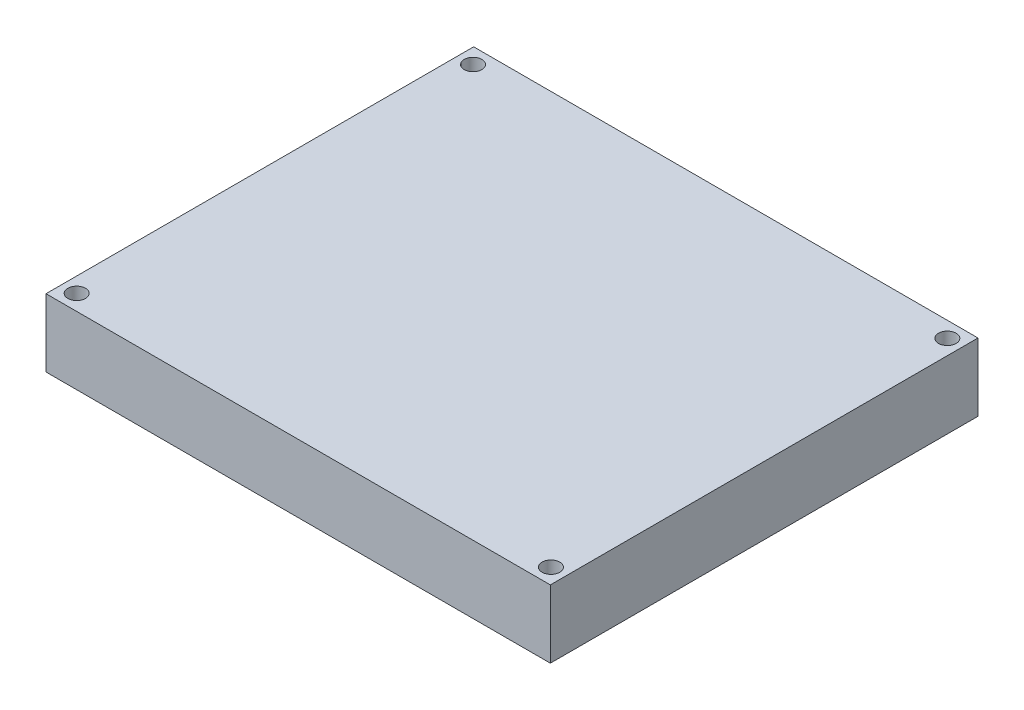
from build123d import *

# Parameters (mm, degrees)
SKETCH_1_W          = 85.5
SKETCH_1_H          = 72.5
SKETCH_1_R          = 1.5
EXTRUDE_1_DEPTH     = 11.5
SKETCH_2_W          = 38.316664863
SKETCH_2_H          = 7.767596006
CUT_EXTRUDE_1_DEPTH = 3


with BuildPart() as part:
    # 草图1 → 凸台-拉伸1 (new body)
    with BuildSketch(Plane(origin=(0, 0, 0), x_dir=(1, 0, 0), z_dir=(0, 1, 0))):
        Rectangle(SKETCH_1_W, SKETCH_1_H)
        with Locations(Location((-40.2, 33.6, 0), (0, 0, 270))):
            Circle(SKETCH_1_R, mode=Mode.SUBTRACT)
        with Locations(Location((40.2, 33.6, 0), (0, 0, 90))):
            Circle(SKETCH_1_R, mode=Mode.SUBTRACT)
        with Locations(Location((40.2, -33.6, 0), (0, 0, 270))):
            Circle(SKETCH_1_R, mode=Mode.SUBTRACT)
        with Locations(Location((-40.2, -33.6, 0), (0, 0, 90))):
            Circle(SKETCH_1_R, mode=Mode.SUBTRACT)
    extrude(amount=EXTRUDE_1_DEPTH)

    # 草图2 → 切除-拉伸1 (cut)
    with BuildSketch(Plane.ZY.offset(42.75)):
        with Locations((5.239217441, 4.947785371)):
            Rectangle(SKETCH_2_W, SKETCH_2_H)
    extrude(amount=-CUT_EXTRUDE_1_DEPTH, mode=Mode.SUBTRACT)


solid = part.part
